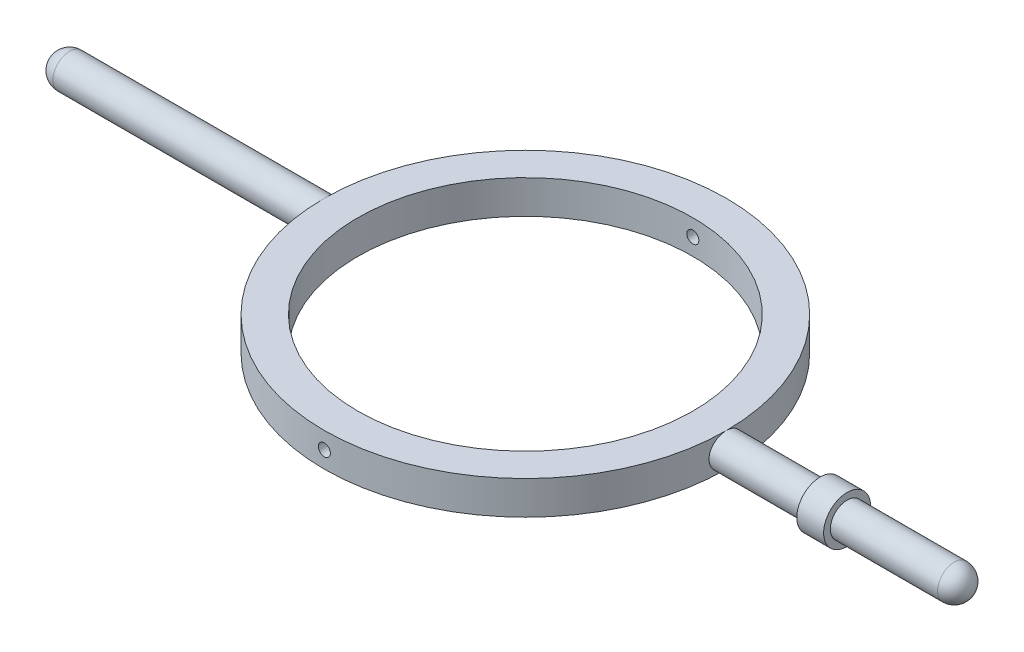
from build123d import *
from build123d.topology import SkipClean

# Parameters (mm, degrees)
SKETCH1_R               = 15
SKETCH1_R_2             = 12.5
BOSS_EXTRUDE2_DEPTH     = 2.5
CUT_EXTRUDE2_DEPTH      = 22.360009363
CUT_EXTRUDE2_DEPTH_BACK = 22.360009363
SKETCH3_R               = 0.45
SKETCH4_R               = 1.25
BOSS_EXTRUDE3_DEPTH     = 18
BOSS_EXTRUDE4_START     = -20
SKETCH6_R               = 1.25
BOSS_EXTRUDE4_DEPTH     = 20
SKETCH9_R               = 1.75
BOSS_EXTRUDE5_DEPTH     = 2


with BuildPart() as part:
    # Sketch1 → Boss-Extrude2 (new body)
    with BuildSketch(Plane(origin=(0, 0, 0), x_dir=(1, 0, 0), z_dir=(0, 1, 0))):
        with Locations(Location((0, 0, 0), (0, 0, 270))):
            Circle(SKETCH1_R)
        with Locations(Location((0, 0, 0), (0, 0, 270))):
            Circle(SKETCH1_R_2, mode=Mode.SUBTRACT)
    extrude(amount=BOSS_EXTRUDE2_DEPTH)

    # Sketch3 → Cut-Extrude2 (cut, two sides: drawn at the far end of the back side and taken through both)
    with BuildSketch(Plane.XY.offset(-CUT_EXTRUDE2_DEPTH_BACK)):
        with Locations(Location((0, 1.25, 0), (0, 0, 89.999999951))):
            Circle(SKETCH3_R)
    extrude(amount=CUT_EXTRUDE2_DEPTH + CUT_EXTRUDE2_DEPTH_BACK, mode=Mode.SUBTRACT)

    # Sketch4 → Boss-Extrude3 (add)
    with SkipClean():  # the faces are left unmerged after this step: merging them gives an invalid solid
        with BuildSketch(Plane(origin=(14, 0, 0), x_dir=(0, 0, -1), z_dir=(1, 0, 0))):
            with Locations(Location((0, 1.25, 0), (0, 0, 90))):
                Circle(SKETCH4_R)
        extrude(amount=BOSS_EXTRUDE3_DEPTH)

    # Sketch5 → Revolve1 (revolve)
    with SkipClean():  # the faces are left unmerged after this step: merging them gives an invalid solid
        with BuildSketch(Plane(origin=(32, 0, 0), x_dir=(0, 0, -1), z_dir=(1, 0, 0))):
            with BuildLine():
                Line((0, 2.5), (0, 0))
                ThreePointArc((0, 0), (1.25, 1.25), (0, 2.5))
            make_face()
        revolve(axis=Axis((32, 2.5, 0), (0, -1, 0)))

    # Sketch6 → Boss-Extrude4 (add)
    with BuildSketch(Plane(origin=(-14, 0, 0), x_dir=(0, 0, -1), z_dir=(1, 0, 0)).offset(BOSS_EXTRUDE4_START)):
        with Locations(Location((0, 1.25, 0), (0, 0, 90))):
            Circle(SKETCH6_R)
    extrude(amount=BOSS_EXTRUDE4_DEPTH)

    # Sketch7 → Revolve2 (revolve)
    with BuildSketch(Plane.ZY.offset(34)):
        with BuildLine():
            Line((0, 2.5), (0, 0))
            ThreePointArc((0, 0), (1.25, 1.25), (0, 2.5))
        make_face()
    revolve(axis=Axis((-34, 2.5, 0), (0, -1, 0)))

    # Sketch9 → Boss-Extrude5 (add)
    with BuildSketch(Plane(origin=(24, 0, 0), x_dir=(0, 0, -1), z_dir=(1, 0, 0))):
        with Locations((0, 1.25)):
            Circle(SKETCH9_R)
    extrude(amount=-BOSS_EXTRUDE5_DEPTH)


solid = part.part
